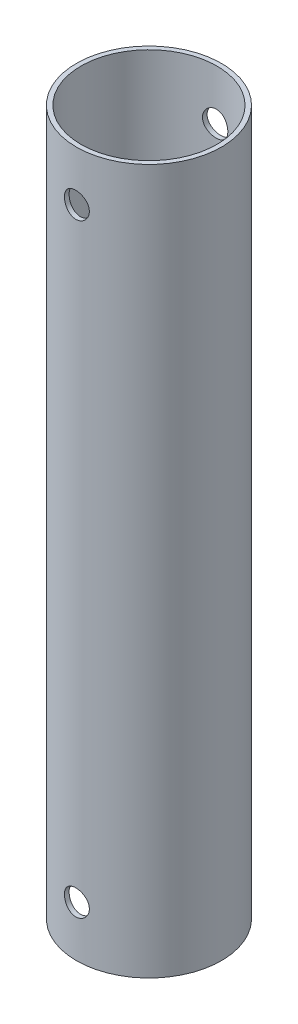
from build123d import *

# Parameters (mm, degrees)
SKETCH1_R               = 15.875
SKETCH1_R_2             = 14.875
BOSS_EXTRUDE1_DEPTH     = 154.2
CUT_EXTRUDE1_DEPTH      = 154.2
CUT_EXTRUDE1_DEPTH_BACK = 154.2
SKETCH2_R               = 2.75


with BuildPart() as part:
    # Sketch1 → Boss-Extrude1 (new body)
    with BuildSketch(Plane(origin=(0, 0, 0), x_dir=(1, 0, 0), z_dir=(0, 1, 0))):
        Circle(SKETCH1_R)
        Circle(SKETCH1_R_2, mode=Mode.SUBTRACT)
    extrude(amount=BOSS_EXTRUDE1_DEPTH)

    # Sketch2 → Cut-Extrude1 (cut, two sides: drawn at the far end of the back side and taken through both)
    with BuildSketch(Plane.XY.offset(-CUT_EXTRUDE1_DEPTH_BACK)):
        with Locations((-0.133461596, 143.2)):
            Circle(SKETCH2_R)
        with Locations((-0.133461596, 11)):
            Circle(SKETCH2_R)
    extrude(amount=CUT_EXTRUDE1_DEPTH + CUT_EXTRUDE1_DEPTH_BACK, mode=Mode.SUBTRACT)


solid = part.part
